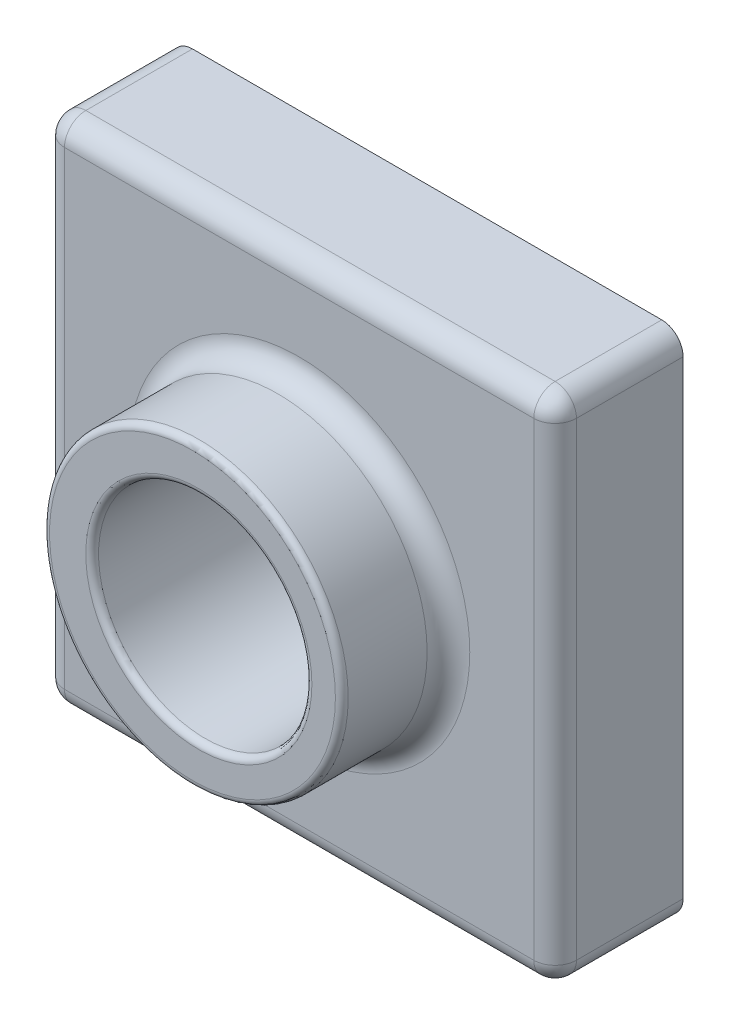
from build123d import *

# Parameters (mm, degrees)
ESQUISSE1_W             = 120
ESQUISSE1_H             = 120
BOSS_EXTRU_1_DEPTH      = 30
ESQUISSE2_R             = 35
BOSS_EXTRU_2_DEPTH      = 25
ESQUISSE3_R             = 25
ENL_V_MAT_EXTRU_1_DEPTH = 179.395627749
CONG_1_R                = 5
CONG_2_R                = 1.5
COQUE1_T                = -2


with BuildPart() as part:
    # Esquisse1 → Boss.-Extru.1 (new body)
    with BuildSketch(Plane.XY):
        with Locations((60, 60)):
            Rectangle(ESQUISSE1_W, ESQUISSE1_H)
    extrude(amount=BOSS_EXTRU_1_DEPTH)

    # Esquisse2 → Boss.-Extru.2 (add)
    with BuildSketch(Plane.XY.offset(30)):
        with Locations((60, 60)):
            Circle(ESQUISSE2_R)
    extrude(amount=BOSS_EXTRU_2_DEPTH)

    # Esquisse3 → Enlèv. mat.-Extru.1 (cut, through all)
    with BuildSketch(Plane.XY.offset(55)):
        with Locations((61.490735972, 60)):
            Circle(ESQUISSE3_R)
    extrude(amount=-ENL_V_MAT_EXTRU_1_DEPTH, mode=Mode.SUBTRACT)

    # Congé1
    cong_1_edges = [part.edges().sort_by_distance(p)[0] for p in [
        (60, 0, 30),
        (25, 60, 30),
        (0, 60, 30),
        (60, 120, 30),
        (0, 120, 15),
        (0, 0, 15),
        (120, 0, 15),
        (120, 120, 15),
        (120, 60, 30),
    ]]
    fillet(cong_1_edges, radius=CONG_1_R)

    # Congé2
    cong_2_edges = [part.edges().sort_by_distance(p)[0] for p in [
        (25, 60, 55),
        (36.490735972, 60, 55),
    ]]
    fillet(cong_2_edges, radius=CONG_2_R)

    # Coque1
    coque1_openings = [part.faces().sort_by_distance(p)[0] for p in [
        (60, 1.697056275, 0),
    ]]
    offset(amount=COQUE1_T, openings=coque1_openings, kind=Kind.INTERSECTION)


solid = part.part
